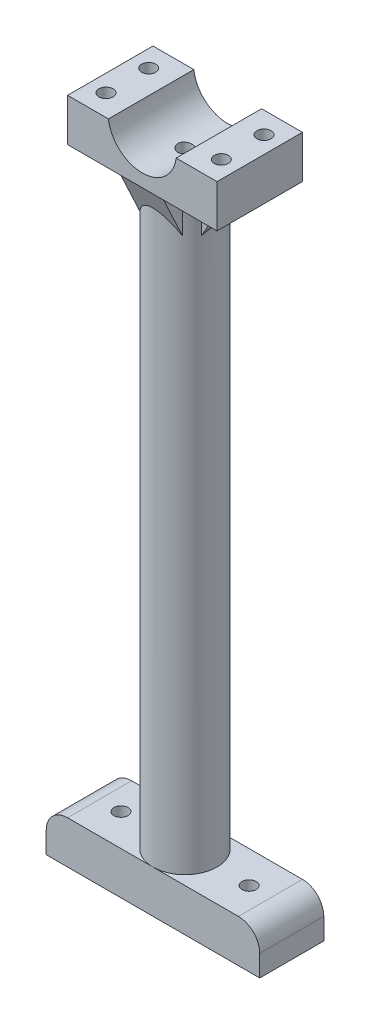
from build123d import *

# Parameters (mm, degrees)
SKETCH_1_W               = 50
SKETCH_1_H               = 15
EXTRUDE_1_DEPTH          = 10
SKETCH_2_R               = 7.5
EXTRUDE_2_DEPTH          = 150
EXTRUDE_3_DEPTH          = 10
EXTRUDE_3_DEPTH_BACK     = 10
CUT_EXTRUDE_2_DEPTH      = 100
CUT_EXTRUDE_2_DEPTH_BACK = 100
SKETCH_5_R               = 1.65
CUT_EXTRUDE_3_DEPTH      = 10
FILLET_1_R               = 5
SKETCH_7_R               = 1.65
CUT_EXTRUDE_4_DEPTH      = 10
EXTRUDE_6_DEPTH          = 3
EXTRUDE_6_DEPTH_BACK     = 3
EXTRUDE_7_DEPTH          = 5
EXTRUDE_7_DEPTH_BACK     = 5


with BuildPart() as part:
    # 草图1 → 凸台-拉伸1 (new body)
    with BuildSketch(Plane(origin=(0, 0, 0), x_dir=(1, 0, 0), z_dir=(0, 1, 0))):
        Rectangle(SKETCH_1_W, SKETCH_1_H)
    extrude(amount=EXTRUDE_1_DEPTH)

    # 草图2 → 凸台-拉伸2 (add)
    with BuildSketch(Plane(origin=(0, 10, 0), x_dir=(1, 0, 0), z_dir=(0, 1, 0))):
        with Locations(Location((0, 0, 0), (0, 0, 270))):
            Circle(SKETCH_2_R)
    extrude(amount=EXTRUDE_2_DEPTH)

    # 草图3 → 凸台-拉伸3 (add, two sides: drawn at the far end of the back side and taken through both)
    with BuildSketch(Plane.XY.offset(-EXTRUDE_3_DEPTH_BACK)):
        with BuildLine():
            ThreePointArc((-10.246950766, 156), (-10.706300052, 157.4750962), (-10.95445115, 159))
            Line((-10.95445115, 159), (-17.5, 159))
            Line((-17.5, 159), (-17.5, 156))
            Line((-17.5, 156), (-10.246950766, 156))
        make_face()
        with BuildLine():
            ThreePointArc((-6.92820323, 156), (-7.582575695, 157.449598888), (-7.937253933, 159))
            Line((-7.937253933, 159), (-10.95445115, 159))
            ThreePointArc((-10.95445115, 159), (-10.706300052, 157.4750962), (-10.246950766, 156))
            Line((-10.246950766, 156), (-6.92820323, 156))
        make_face()
        with BuildLine():
            Line((10.95445115, 159), (7.937253933, 159))
            ThreePointArc((7.937253933, 159), (7.582575695, 157.449598888), (6.92820323, 156))
            Line((6.92820323, 156), (10.246950766, 156))
            ThreePointArc((10.246950766, 156), (10.706300052, 157.4750962), (10.95445115, 159))
        make_face()
        with BuildLine():
            ThreePointArc((6.92820323, 156), (4, 153.07179677), (0, 152))
            Line((0, 152), (0, 149))
            ThreePointArc((0, 149), (6.204836823, 150.917048938), (10.246950766, 156))
            Line((10.246950766, 156), (6.92820323, 156))
        make_face()
        with BuildLine():
            Line((0, 149), (0, 152))
            ThreePointArc((0, 152), (-4, 153.07179677), (-6.92820323, 156))
            Line((-6.92820323, 156), (-10.246950766, 156))
            ThreePointArc((-10.246950766, 156), (-6.204836823, 150.917048938), (0, 149))
        make_face()
        with BuildLine():
            Line((17.5, 159), (10.95445115, 159))
            ThreePointArc((10.95445115, 159), (10.706300052, 157.4750962), (10.246950766, 156))
            Line((10.246950766, 156), (17.5, 156))
            Line((17.5, 156), (17.5, 159))
        make_face()
        with BuildLine():
            Line((-17.5, 149), (0, 149))
            ThreePointArc((0, 149), (-6.204836823, 150.917048938), (-10.246950766, 156))
            Line((-10.246950766, 156), (-17.5, 156))
            Line((-17.5, 156), (-17.5, 149))
        make_face()
        with BuildLine():
            ThreePointArc((10.246950766, 156), (6.204836823, 150.917048938), (0, 149))
            Line((0, 149), (17.5, 149))
            Line((17.5, 149), (17.5, 156))
            Line((17.5, 156), (10.246950766, 156))
        make_face()
    extrude(amount=EXTRUDE_3_DEPTH + EXTRUDE_3_DEPTH_BACK)

    # 草图4 → 切除-拉伸2 (cut, two sides: drawn at the far end of the back side and taken through both)
    with BuildSketch(Plane.XY.offset(-CUT_EXTRUDE_2_DEPTH_BACK)):
        with BuildLine():
            Line((8, 160), (-8, 160))
            ThreePointArc((-8, 160), (-7.899200485, 158.734049095), (-7.599342077, 157.5))
            Line((-7.599342077, 157.5), (7.599342077, 157.5))
            ThreePointArc((7.599342077, 157.5), (7.899200485, 158.734049095), (8, 160))
        make_face()
        with BuildLine():
            Line((7.599342077, 157.5), (-7.599342077, 157.5))
            ThreePointArc((-7.599342077, 157.5), (0, 152), (7.599342077, 157.5))
        make_face()
    extrude(amount=CUT_EXTRUDE_2_DEPTH + CUT_EXTRUDE_2_DEPTH_BACK, mode=Mode.SUBTRACT)

    # 草图5 → 切除-拉伸3 (cut)
    with BuildSketch(Plane.XZ):
        with Locations(Location((0, 0, 0), (0, 0, 270))):
            Circle(SKETCH_5_R)
        with Locations(Location((-15, 0, 0), (0, 0, 270))):
            Circle(SKETCH_5_R)
        with Locations(Location((15, 0, 0), (0, 0, 270))):
            Circle(SKETCH_5_R)
    extrude(amount=-CUT_EXTRUDE_3_DEPTH, mode=Mode.SUBTRACT)

    # 草图6 → 切除-旋转1 (revolve, cut)
    with BuildSketch(Plane.XY, mode=Mode.PRIVATE) as cut_revolve_1_sk:
        Polygon((0, 10), (0, 20), (1.4, 20), (1.4, 15), (1.65, 10), align=None)
    revolve(cut_revolve_1_sk.sketch.rotate(Axis((0, 10, 0), (0, 1, 0)), 90), axis=Axis((0, 10, 0), (0, 1, 0)), mode=Mode.SUBTRACT)

    # 圆角1
    fillet_1_edges = [part.edges().sort_by_distance(p)[0] for p in [
        (-25, 10, 0),
        (25, 10, 0),
    ]]
    fillet(fillet_1_edges, radius=FILLET_1_R)

    # 草图9 → 切除-旋转2 (revolve, cut)
    with BuildSketch(Plane.XY, mode=Mode.PRIVATE) as cut_revolve_2_sk:
        Polygon((0, 152), (0, 153.423684137), (1.65, 153.423684137), (1.65, 149), (1.4, 144.61976638), (0, 144.61976638), (0, 149), align=None)
    revolve(cut_revolve_2_sk.sketch.rotate(Axis((0, 152, 0), (0, -1, 0)), 180), axis=Axis((0, 152, 0), (0, -1, 0)), mode=Mode.SUBTRACT)

    # 草图7 → 切除-拉伸4 (cut)
    with BuildSketch(Plane.XZ.offset(-149)):
        with Locations(Location((-13.5, 5, 0), (0, 0, 270))):
            Circle(SKETCH_7_R)
        with Locations(Location((-13.5, -5, 0), (0, 0, 270))):
            Circle(SKETCH_7_R)
        with Locations(Location((13.5, 5, 0), (0, 0, 270))):
            Circle(SKETCH_7_R)
        with Locations(Location((13.5, -5, 0), (0, 0, 270))):
            Circle(SKETCH_7_R)
    extrude(amount=-CUT_EXTRUDE_4_DEPTH, mode=Mode.SUBTRACT)

    # 草图10 → 凸台-拉伸6 (add, two sides: drawn at the far end of the back side and taken through both)
    with BuildSketch(Plane.XY.offset(-EXTRUDE_6_DEPTH_BACK)):
        Polygon((-12.5, 149), (-7.5, 149), (-7.5, 140.339745962), align=None)
        Polygon((0, 127.349364905), (0, 149), (-7.5, 149), (-7.5, 140.339745962), align=None)
        Polygon((7.5, 140.339745962), (7.5, 149), (0, 149), (0, 127.349364905), align=None)
        Polygon((7.5, 140.339745962), (12.5, 149), (7.5, 149), align=None)
    extrude(amount=EXTRUDE_6_DEPTH + EXTRUDE_6_DEPTH_BACK)

    # 草图11 → 凸台-拉伸7 (add, two sides: drawn at the far end of the back side and taken through both)
    with BuildSketch(Plane(origin=(0, 0, 0), x_dir=(0, 0, -1), z_dir=(1, 0, 0)).offset(-EXTRUDE_7_DEPTH_BACK)):
        Polygon((0, 149), (-10, 149), (0, 127.554930795), align=None)
        Polygon((10, 149), (0, 149), (0, 127.554930795), align=None)
    extrude(amount=EXTRUDE_7_DEPTH + EXTRUDE_7_DEPTH_BACK)


solid = part.part
